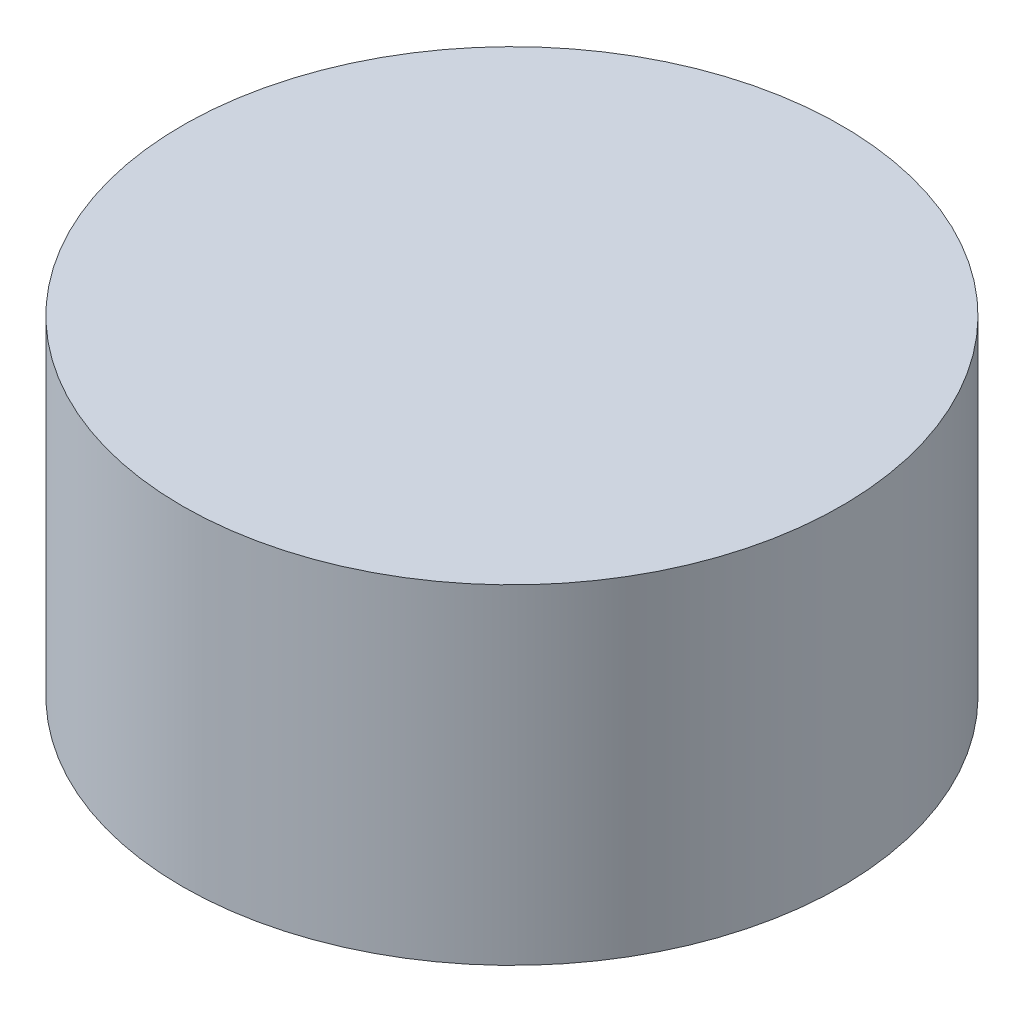
from build123d import *

# Parameters (mm, degrees)
SKETCH1_R           = 60
BOSS_EXTRUDE1_DEPTH = 60
SKETCH2_R           = 60
BOSS_EXTRUDE2_DEPTH = 60


with BuildPart() as part:
    # Sketch1 → Boss-Extrude1 (new body)
    with BuildSketch(Plane(origin=(0, 0, 0), x_dir=(1, 0, 0), z_dir=(0, 1, 0))):
        Circle(SKETCH1_R)
    extrude(amount=BOSS_EXTRUDE1_DEPTH)

    # Sketch2 → Boss-Extrude2 (add)
    with BuildSketch(Plane(origin=(0, 0, 0), x_dir=(1, 0, 0), z_dir=(0, 1, 0))):
        Circle(SKETCH2_R)
    extrude(amount=BOSS_EXTRUDE2_DEPTH)


solid = part.part
